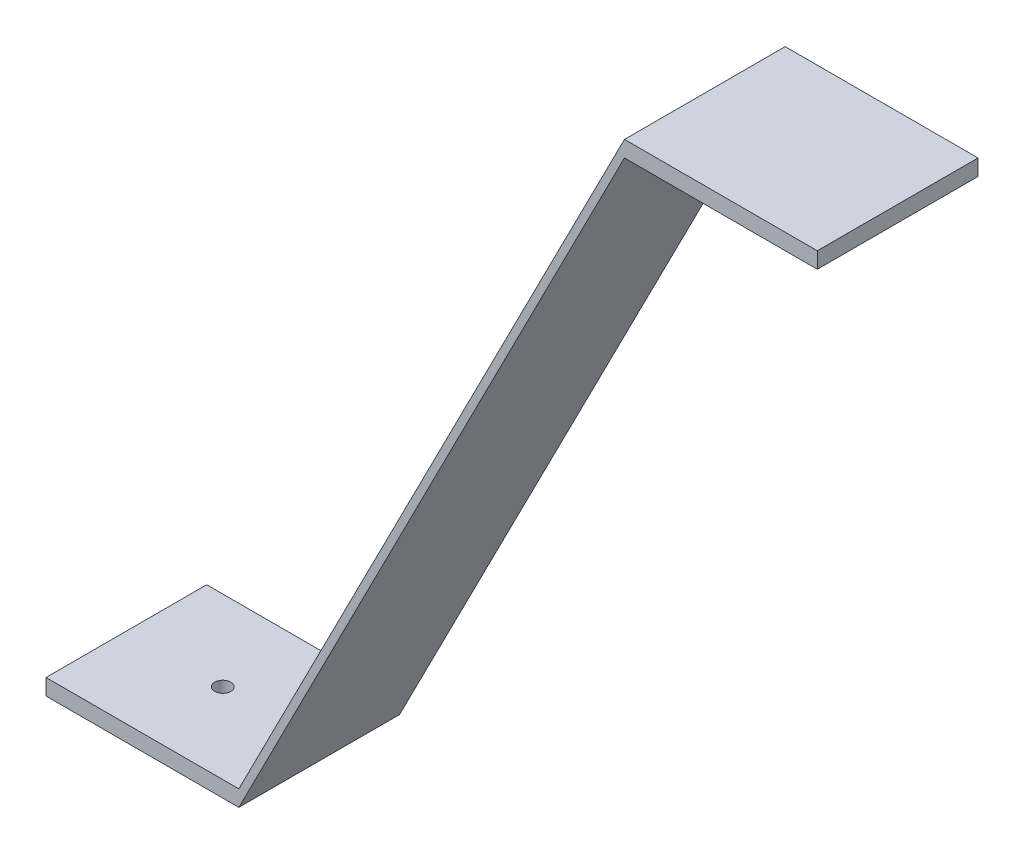
from build123d import *

# Parameters (mm, degrees)
SKETCH1_W           = 76.2
SKETCH1_H           = 63.5
BOSS_EXTRUDE1_DEPTH = 6.35
SKETCH2_R           = 3.175
CUT_EXTRUDE1_DEPTH  = 50.99995
BOSS_EXTRUDE2_DEPTH = 63.5
SKETCH4_W           = 63.5
SKETCH4_H           = 6.35
BOSS_EXTRUDE3_DEPTH = 76.2


with BuildPart() as part:
    # Sketch1 → Boss-Extrude1 (new body)
    with BuildSketch(Plane(origin=(0, 0, 0), x_dir=(1, 0, 0), z_dir=(0, 1, 0))):
        Rectangle(SKETCH1_W, SKETCH1_H)
    extrude(amount=BOSS_EXTRUDE1_DEPTH)

    # Sketch2 → Cut-Extrude1 (cut, through all)
    with BuildSketch(Plane(origin=(0, 6.35, 0), x_dir=(1, 0, 0), z_dir=(0, 1, 0))):
        with Locations(Location((0, 0, 0), (0, 0, 270))):
            Circle(SKETCH2_R)
    extrude(amount=-CUT_EXTRUDE1_DEPTH, mode=Mode.SUBTRACT)

    # Sketch3 → Boss-Extrude2 (add)
    with BuildSketch(Plane.XY.offset(31.75)):
        Polygon((38.1, 6.35), (190.5, 304.8), (190.5, 298.45), (38.1, 0), align=None)
    extrude(amount=-BOSS_EXTRUDE2_DEPTH)

    # Sketch4 → Boss-Extrude3 (add)
    with BuildSketch(Plane(origin=(190.5, 0, 0), x_dir=(0, 0, -1), z_dir=(1, 0, 0))):
        with Locations((0, 301.625)):
            Rectangle(SKETCH4_W, SKETCH4_H)
    extrude(amount=BOSS_EXTRUDE3_DEPTH)


solid = part.part
